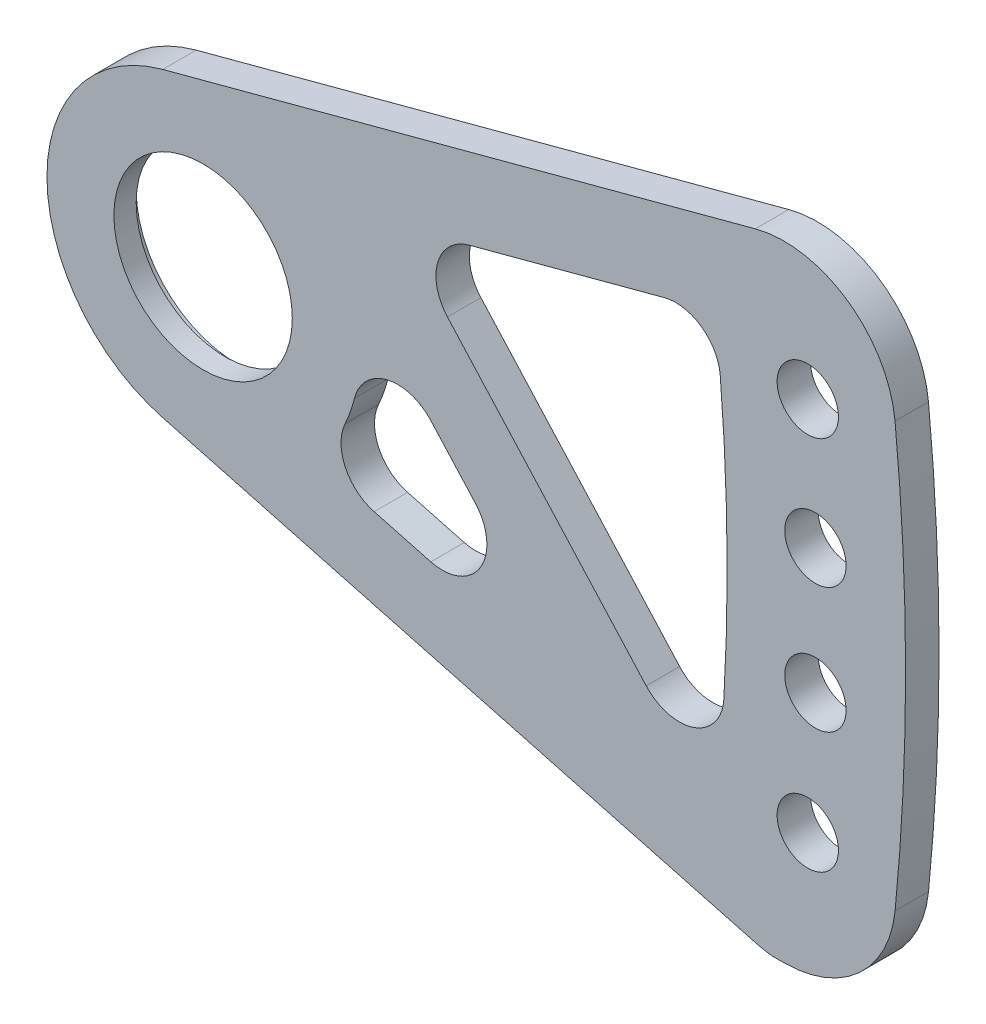
from build123d import *

# Parameters (mm, degrees)
SKETCH_1_R          = 8
EXTRUDE_1_DEPTH     = 3
HOLE_WIZARD_M31_D   = 3.4
HOLE_WIZARD_M51_D   = 5.5
HOLE_WIZARD_M52_D   = 5.5
FILLET_1_R          = 10
FILLET_2_R          = 5
SKETCH_9_R          = 9
CUT_EXTRUDE_2_DEPTH = 1
CUT_EXTRUDE_3_DEPTH = 195.061830596
CUT_EXTRUDE_4_DEPTH = 195.061830596
CUT_EXTRUDE_6_DEPTH = 195.061830596
FILLET_6_R          = 4


with BuildPart() as part:
    # Эскиз1 → Бобышка-Вытянуть1 (new body)
    with BuildSketch(Plane.XY):
        with BuildLine():
            Line((-9.508526364, -3.096437692), (-1.398717752, -28))
            Line((-1.398717752, -28), (189.947361129, -28))
            ThreePointArc((189.947361129, -28), (191.995297124, 1.34383112), (189.536809823, 30.656120467))
            Line((189.536809823, 30.656120467), (125.388049295, 13.526041997))
            ThreePointArc((125.388049295, 13.526041997), (123.105499175, 12.698616461), (121.000225207, 11.489282104))
            Line((121.000225207, 11.489282104), (83.76563687, -14.436473614))
            Line((83.76563687, -14.436473614), (63.718090084, -22))
            Line((63.718090084, -22), (35.731449132, -22))
            Line((35.731449132, -22), (20.675178874, -13.02912429))
            Line((20.675178874, -13.02912429), (8.326583423, 5.537870395))
            ThreePointArc((8.326583423, 5.537870395), (-4.357415095, 9.00071851), (-9.508526364, -3.096437692))
        make_face()
        with Locations((129, 0)):
            Circle(SKETCH_1_R, mode=Mode.SUBTRACT)
    extrude(amount=EXTRUDE_1_DEPTH)

    # Отверстие с зазором M31 (through all)
    with Locations(Plane.XY.offset(3)):
        with Locations((9, -25), (40.5, -25), (72, -25)):
            Hole(HOLE_WIZARD_M31_D / 2)

    # Отверстие с зазором M51 (through all)
    with Locations(Plane.XY.offset(3)):
        with Locations((0, 0)):
            Hole(HOLE_WIZARD_M51_D / 2)

    # Отверстие с зазором M52 (through all)
    with Locations(Plane.XY.offset(3)):
        with Locations((183.228106674, 16.836297834), (183.914180714, 5.619086431), (183.914180714, -5.619086431), (183.228106674, -16.836297834)):
            Hole(HOLE_WIZARD_M52_D / 2)

    # Скругление1
    fillet_1_edges = [part.edges().sort_by_distance(p)[0] for p in [
        (35.731449132, -22, 1.5),
        (63.718090084, -22, 1.5),
        (83.76563687, -14.436473614, 1.5),
        (189.536809823, 30.656120467, 1.5),
        (189.947361129, -28, 1.5),
        (20.675178874, -13.02912429, 1.5),
    ]]
    fillet(fillet_1_edges, radius=FILLET_1_R)

    # Скругление2
    fillet_2_edges = [part.edges().sort_by_distance(p)[0] for p in [
        (-1.398717752, -28, 1.5),
    ]]
    fillet(fillet_2_edges, radius=FILLET_2_R)

    # Эскиз9 → Вырез-Вытянуть2 (cut)
    with BuildSketch(Plane(origin=(0, 0, 0), x_dir=(-1, 0, 0), z_dir=(0, 0, -1))):
        with Locations((-129, 0)):
            Circle(SKETCH_9_R)
    extrude(amount=-CUT_EXTRUDE_2_DEPTH, mode=Mode.SUBTRACT)

    # Эскиз10 → Вырез-Вытянуть3 (cut, through all)
    with BuildSketch(Plane.XY.offset(3)):
        with BuildLine():
            Line((6.5, -23.3), (11.5, -23.3))
            ThreePointArc((11.5, -23.3), (13.2, -25), (11.5, -26.7))
            Line((11.5, -26.7), (6.5, -26.7))
            ThreePointArc((6.5, -26.7), (4.8, -25), (6.5, -23.3))
        make_face()
        with BuildLine():
            Line((38, -23.3), (43, -23.3))
            ThreePointArc((43, -23.3), (44.7, -25), (43, -26.7))
            Line((43, -26.7), (38, -26.7))
            ThreePointArc((38, -26.7), (36.3, -25), (38, -23.3))
        make_face()
        with BuildLine():
            Line((69.5, -23.3), (74.5, -23.3))
            ThreePointArc((74.5, -23.3), (76.2, -25), (74.5, -26.7))
            Line((74.5, -26.7), (69.5, -26.7))
            ThreePointArc((69.5, -26.7), (67.8, -25), (69.5, -23.3))
        make_face()
    extrude(amount=-CUT_EXTRUDE_3_DEPTH, mode=Mode.SUBTRACT)

    # Эскиз12 → Вырез-Вытянуть4 (cut, through all)
    with BuildSketch(Plane(origin=(0, 0, 0), x_dir=(-1, 0, 0), z_dir=(0, 0, -1))):
        with BuildLine():
            Line((-178.522421187, -27.714873589), (-125.388049295, -13.526041997))
            ThreePointArc((-125.388049295, -13.526041997), (-115, 0), (-125.388049295, 13.526041997))
            Line((-125.388049295, 13.526041997), (17.708535377, 18.690586902))
            Line((17.708535377, 18.690586902), (9.18577518, -30.07854089))
            Line((9.18577518, -30.07854089), (-194.865610091, -30.07854089))
            Line((-194.865610091, -30.07854089), (-191.053066524, -19.0453609))
            ThreePointArc((-191.053066524, -19.0453609), (-186.79202351, -26.277041029), (-178.522421187, -27.714873589))
        make_face()
    extrude(amount=-CUT_EXTRUDE_4_DEPTH, mode=Mode.SUBTRACT)

    # Эскиз14 → Вырез-Вытянуть6 (cut, through all)
    with BuildSketch(Plane(origin=(0, 0, 0), x_dir=(-1, 0, 0), z_dir=(0, 0, -1))):
        with BuildLine():
            Line((-174.915688269, 19.506460401), (-146.526487717, 11.925499691))
            Line((-146.526487717, 11.925499691), (-174.915688269, -19.506460401))
            ThreePointArc((-174.915688269, -19.506460401), (-176, 0), (-174.915688269, 19.506460401))
        make_face()
        with BuildLine():
            Line((-139.389594338, 9.383833412), (-162.485080357, -16.187030888))
            Line((-162.485080357, -16.187030888), (-138.90792063, -9.891062066))
            ThreePointArc((-138.90792063, -9.891062066), (-142.995630653, -0.349746504), (-139.389594338, 9.383833412))
        make_face()
    extrude(amount=-CUT_EXTRUDE_6_DEPTH, mode=Mode.SUBTRACT)

    # Скругление6
    fillet_6_edges = [part.edges().sort_by_distance(p)[0] for p in [
        (174.915688269, -19.506460401, 1.5),
        (174.915688269, 19.506460401, 1.5),
        (146.526487717, 11.925499691, 1.5),
        (139.389594338, 9.383833412, 1.5),
        (138.90792063, -9.891062066, 1.5),
        (162.485080357, -16.187030888, 1.5),
    ]]
    fillet(fillet_6_edges, radius=FILLET_6_R)


solid = part.part
